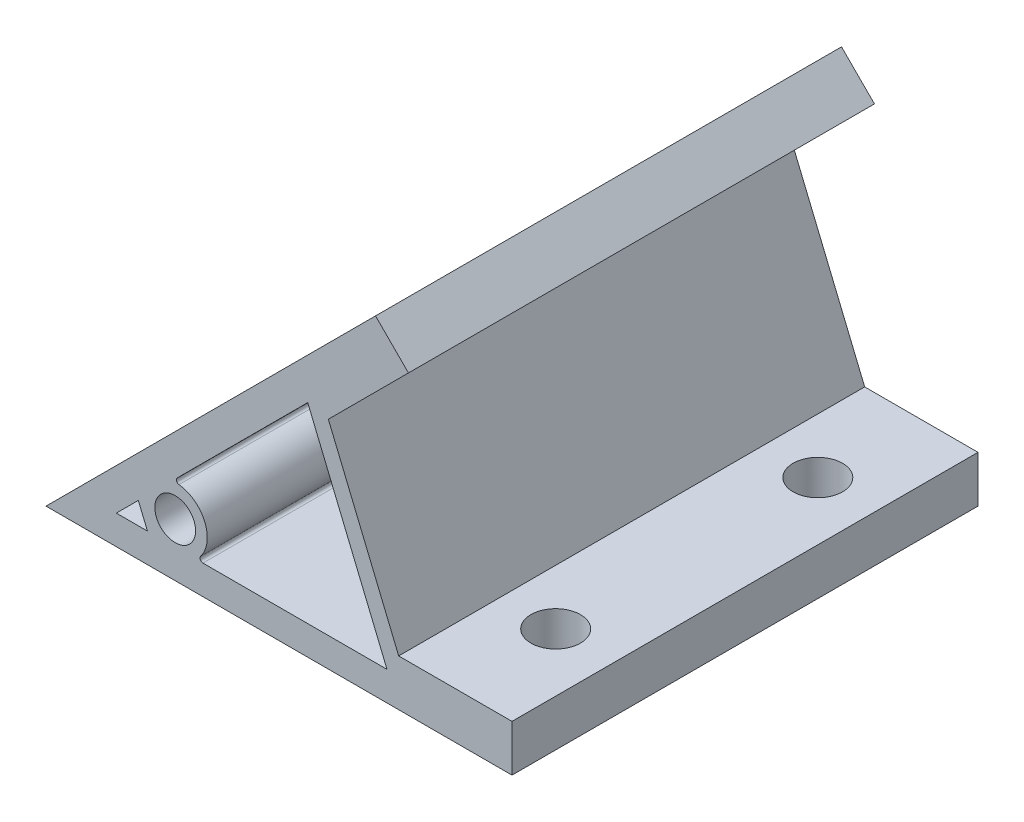
from build123d import *

# Parameters (mm, degrees)
SKETCH_1_R          = 3.5
EXTRUDE_1_DEPTH     = 40
SKETCH_2_R          = 4.25
CUT_EXTRUDE_1_DEPTH = 20
SKETCH_3_R          = 4.25
CUT_EXTRUDE_2_DEPTH = 20


with BuildPart() as part:
    # 草图1 → 凸台-拉伸1 (new, symmetric)
    with BuildSketch(Plane.XY):
        Polygon((0, 0), (56.568542495, 56.568542495), (62.225396744, 50.911688245), (48.470353518, 37.156645019), (60.547431318, 8), (80, 8), (80, 0), align=None)
        with Locations((22.184677187, 9.156473773)):
            Circle(SKETCH_1_R, mode=Mode.SUBTRACT)
        Polygon((12.071067812, 5), (15.847671377, 8.776603565), (17.411991793, 5), align=None, mode=Mode.SUBTRACT)
        with BuildLine():
            Line((22.539170943, 15.468103131), (44.931612237, 37.860544425))
            Line((44.931612237, 37.860544425), (58.542895405, 5))
            Line((58.542895405, 5), (26.941798117, 5))
            ThreePointArc((26.941798117, 5), (26.493271042, 5.27903968), (26.545371373, 5.804706148))
            ThreePointArc((26.545371373, 5.804706148), (27.253512915, 11.291164467), (22.833720405, 14.61804341))
            ThreePointArc((22.833720405, 14.61804341), (22.420282519, 14.950846558), (22.539170943, 15.468103131))
        make_face(mode=Mode.SUBTRACT)
    extrude(amount=EXTRUDE_1_DEPTH, both=True)

    # 草图2 → 切除-拉伸1 (cut)
    with BuildSketch(Plane(origin=(0, 0, 0), x_dir=(0, 0, 1), z_dir=(-0.7071067811865488, 0.7071067811865464, 0))):
        with Locations(Location((22.5, 70, 0), (0, 0, 270))):
            Circle(SKETCH_2_R)
        with Locations(Location((-22.5, 70, 0), (0, 0, 270))):
            Circle(SKETCH_2_R)
    extrude(amount=-CUT_EXTRUDE_1_DEPTH, mode=Mode.SUBTRACT)

    # 草图3 → 切除-拉伸2 (cut)
    with BuildSketch(Plane.XZ):
        with Locations(Location((70, 22.5, 0), (0, 0, 270))):
            Circle(SKETCH_3_R)
        with Locations(Location((70, -22.5, 0), (0, 0, 270))):
            Circle(SKETCH_3_R)
    extrude(amount=-CUT_EXTRUDE_2_DEPTH, mode=Mode.SUBTRACT)


solid = part.part
